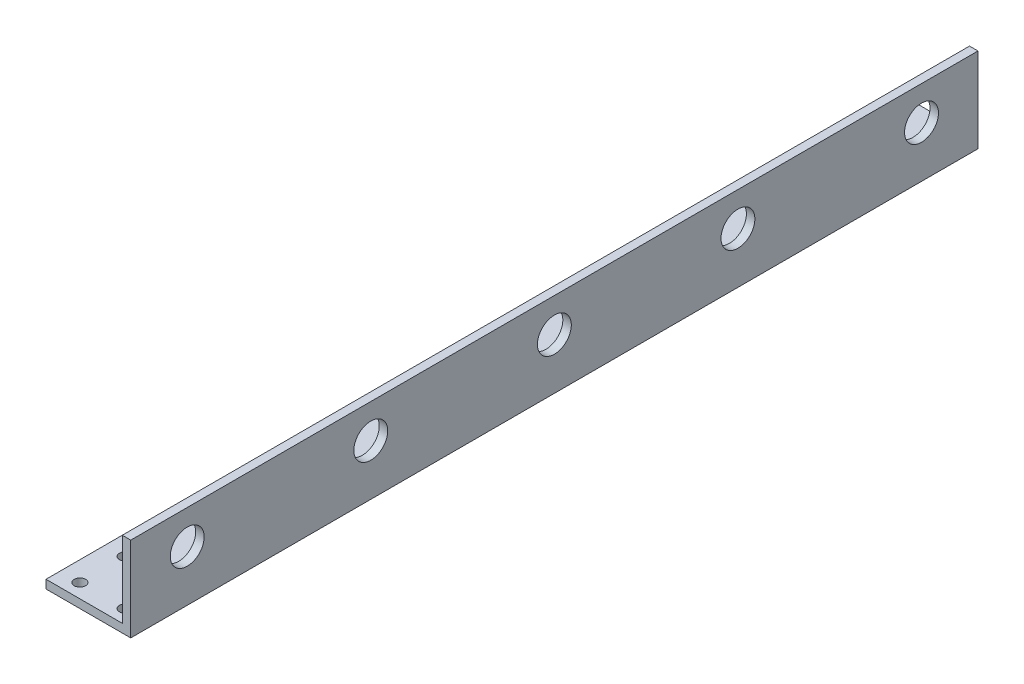
from build123d import *

# Parameters (mm, degrees)
EXTRUDE_1_DEPTH     = 300
SKETCH_2_R          = 6
CUT_EXTRUDE_1_DEPTH = 300
SKETCH_3_R          = 2
CUT_EXTRUDE_2_DEPTH = 300


with BuildPart() as part:
    # 草图1 → 凸台-拉伸1 (new body)
    with BuildSketch(Plane.XY):
        Polygon((-15, -15), (15, -15), (15, 15), (12, 15), (12, -12), (-15, -12), align=None)
    extrude(amount=EXTRUDE_1_DEPTH)

    # 草图2 → 切除-拉伸1 (cut)
    with BuildSketch(Plane.ZY.offset(-12)):
        with Locations((20, 3)):
            Circle(SKETCH_2_R)
        with Locations((85, 3)):
            Circle(SKETCH_2_R)
        with Locations((150, 3)):
            Circle(SKETCH_2_R)
        with Locations((215, 3)):
            Circle(SKETCH_2_R)
        with Locations((280, 3)):
            Circle(SKETCH_2_R)
    extrude(amount=-CUT_EXTRUDE_1_DEPTH, mode=Mode.SUBTRACT)

    # 草图3 → 切除-拉伸2 (cut)
    with BuildSketch(Plane.XZ.offset(15)):
        with Locations(Location((-8, 295, 0), (0, 0, 270))):
            Circle(SKETCH_3_R)
        with Locations(Location((-8, 279, 0), (0, 0, 270))):
            Circle(SKETCH_3_R)
        with Locations(Location((8, 279, 0), (0, 0, 270))):
            Circle(SKETCH_3_R)
        with Locations(Location((8, 295, 0), (0, 0, 270))):
            Circle(SKETCH_3_R)
        with Locations(Location((-8, 21, 0), (0, 0, 270))):
            Circle(SKETCH_3_R)
        with Locations(Location((-8, 5, 0), (0, 0, 270))):
            Circle(SKETCH_3_R)
        with Locations(Location((8, 5, 0), (0, 0, 270))):
            Circle(SKETCH_3_R)
        with Locations(Location((8, 21, 0), (0, 0, 270))):
            Circle(SKETCH_3_R)
    extrude(amount=-CUT_EXTRUDE_2_DEPTH, mode=Mode.SUBTRACT)


solid = part.part
